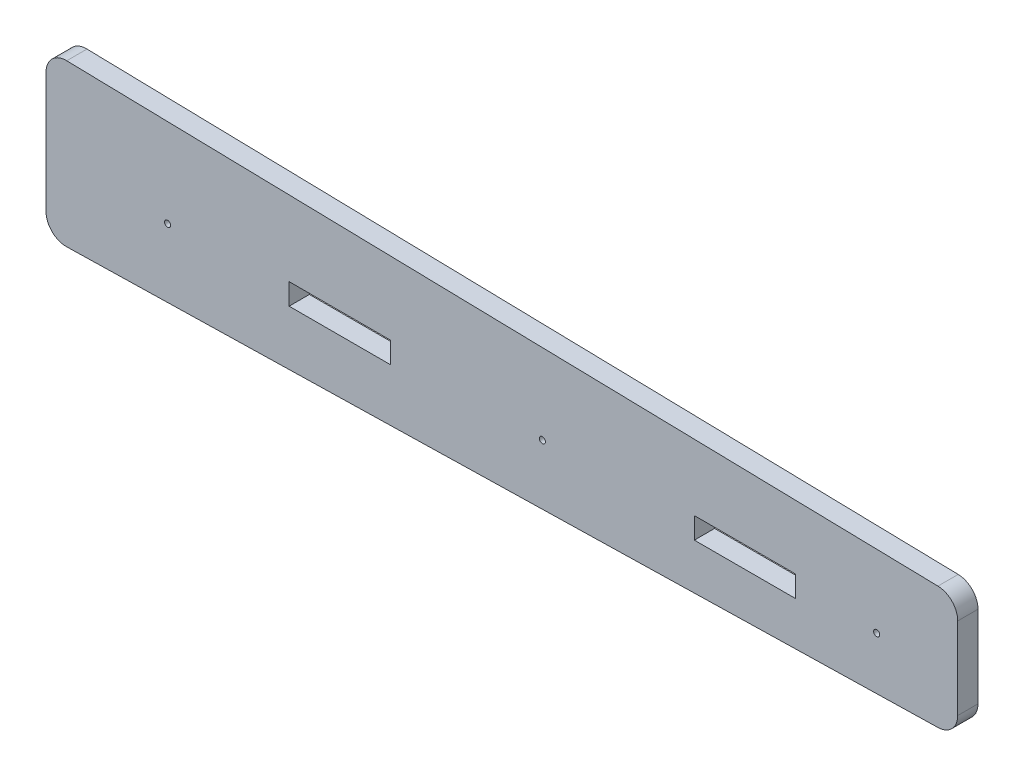
from build123d import *

# Parameters (mm, degrees)
SKETCH1_W              = 50
SKETCH1_H              = 10.5
EXTRUDE_582_DEPTH      = 10
FILLET1_R              = 10
CUT_EXTRUDE_1185_REACH = 230.707
SKETCH2_R              = 1.5


with BuildPart() as part:
    # Sketch1 → Extrude 582 (new body)
    with BuildSketch(Plane.XY):
        Polygon((-225, 40), (-225, -40), (225, -30), (225, 30), align=None)
        with Locations((-80, -5)):
            Rectangle(SKETCH1_W, SKETCH1_H, mode=Mode.SUBTRACT)
        with Locations((120, -5)):
            Rectangle(SKETCH1_W, SKETCH1_H, mode=Mode.SUBTRACT)
    extrude(amount=EXTRUDE_582_DEPTH)

    # Fillet1
    fillet1_edges = [part.edges().sort_by_distance(p)[0] for p in [
        (225, 30, 5),
        (225, -30, 5),
        (-225, -40, 5),
        (-225, 40, 5),
    ]]
    fillet(fillet1_edges, radius=FILLET1_R)

    # Sketch2 → Cut-Extrude 1185 (cut, up to next)
    with BuildSketch(Plane.XY.offset(10), mode=Mode.PRIVATE) as cut_extrude_1185_sk1:
        with Locations((-165, -5)):
            Circle(SKETCH2_R)
    cut_extrude_1185_tool1 = extrude(cut_extrude_1185_sk1.sketch, amount=-CUT_EXTRUDE_1185_REACH, mode=Mode.PRIVATE) & part.part
    # Sketch2 → Cut-Extrude 1185 (cut, up to next)
    with BuildSketch(Plane.XY.offset(10), mode=Mode.PRIVATE) as cut_extrude_1185_sk2:
        with Locations((20, -5)):
            Circle(SKETCH2_R)
    cut_extrude_1185_tool2 = extrude(cut_extrude_1185_sk2.sketch, amount=-CUT_EXTRUDE_1185_REACH, mode=Mode.PRIVATE) & part.part
    # Sketch2 → Cut-Extrude 1185 (cut, up to next)
    with BuildSketch(Plane.XY.offset(10), mode=Mode.PRIVATE) as cut_extrude_1185_sk3:
        with Locations((185, -5)):
            Circle(SKETCH2_R)
    cut_extrude_1185_tool3 = extrude(cut_extrude_1185_sk3.sketch, amount=-CUT_EXTRUDE_1185_REACH, mode=Mode.PRIVATE) & part.part
    add(cut_extrude_1185_tool1.solids().sort_by_distance((-165, -5, 10))[0], mode=Mode.SUBTRACT)
    add(cut_extrude_1185_tool2.solids().sort_by_distance((20, -5, 10))[0], mode=Mode.SUBTRACT)
    add(cut_extrude_1185_tool3.solids().sort_by_distance((185, -5, 10))[0], mode=Mode.SUBTRACT)


solid = part.part
